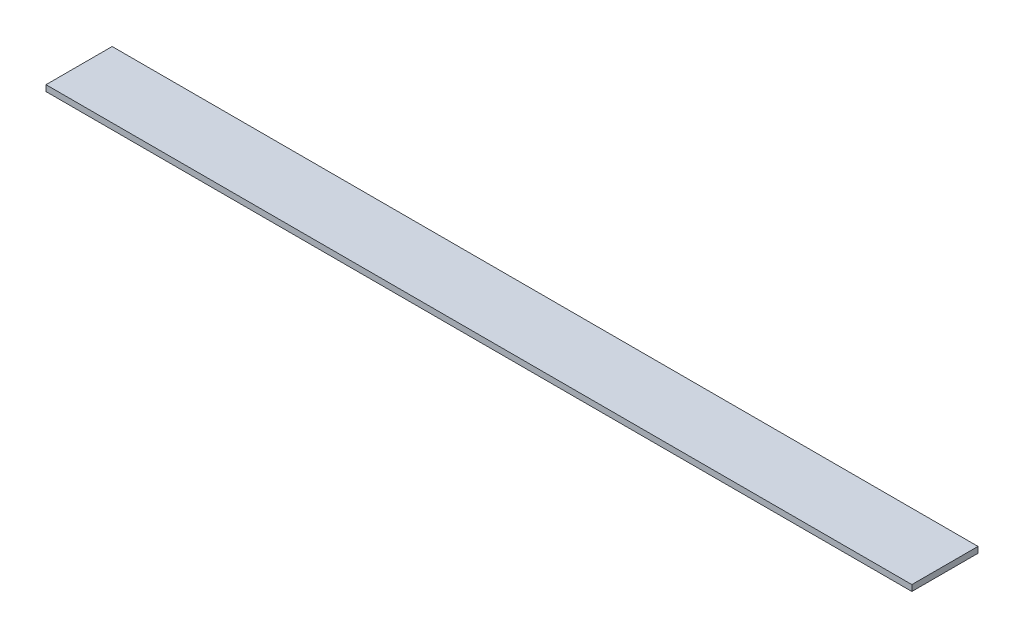
from build123d import *

# Parameters (mm, degrees)
SKETCH1_W           = 1828.8
SKETCH1_H           = 139.7
BOSS_EXTRUDE1_DEPTH = 12.7


with BuildPart() as part:
    # Sketch1 → Boss-Extrude1 (new body)
    with BuildSketch(Plane(origin=(0, 0, 0), x_dir=(1, 0, 0), z_dir=(0, 1, 0))):
        with Locations((874.865206316, 36.158399093)):
            Rectangle(SKETCH1_W, SKETCH1_H)
    extrude(amount=BOSS_EXTRUDE1_DEPTH)


solid = part.part
